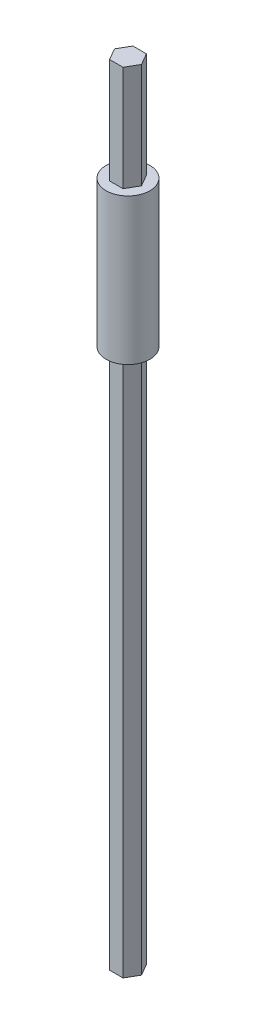
from build123d import *

# Parameters (mm, degrees)
CROQUIS2_R              = 3.75
SALIENTE_EXTRUIR2_DEPTH = 25
SALIENTE_EXTRUIR4_DEPTH = 18
SALIENTE_EXTRUIR6_DEPTH = 92


with BuildPart() as part:
    # Croquis2 → Saliente-Extruir2 (new body)
    with BuildSketch(Plane(origin=(0, 71.3, 0), x_dir=(1, 0, 0), z_dir=(0, 1, 0))):
        with Locations(Location((1.555634919, 1.555634919, 0), (0, 0, 270))):
            Circle(CROQUIS2_R)
    extrude(amount=SALIENTE_EXTRUIR2_DEPTH)

    # Croquis3 → Saliente-Extruir4 (add)
    with BuildSketch(Plane(origin=(0, 96.3, 0), x_dir=(1, 0, 0), z_dir=(0, 1, 0))):
        Polygon((3.865035995, 1.555634919), (2.710335457, 3.555634919), (0.40093438, 3.555634919), (-0.753766158, 1.555634919), (0.40093438, -0.444365081), (2.710335457, -0.444365081), align=None)
    extrude(amount=SALIENTE_EXTRUIR4_DEPTH)

    # Croquis4 → Saliente-Extruir6 (add)
    with BuildSketch(Plane.XZ.offset(-71.3)):
        Polygon((3.865035995, -1.555634919), (2.710335457, 0.444365081), (0.40093438, 0.444365081), (-0.753766158, -1.555634919), (0.40093438, -3.555634919), (2.710335457, -3.555634919), align=None)
    extrude(amount=SALIENTE_EXTRUIR6_DEPTH)


solid = part.part
